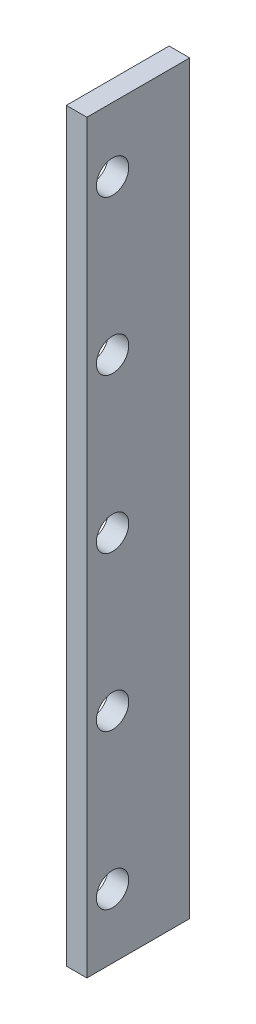
from build123d import *

# Parameters (mm, degrees)
SKETCH1_W           = 16
SKETCH1_H           = 80
BOSS_EXTRUDE1_DEPTH = 580
SKETCH2_R           = 12.6
CUT_EXTRUDE1_DEPTH  = 586.709825767


with BuildPart() as part:
    # Sketch1 → Boss-Extrude1 (new body)
    with BuildSketch(Plane(origin=(0, 0, 0), x_dir=(1, 0, 0), z_dir=(0, 1, 0))):
        with Locations((8, 40)):
            Rectangle(SKETCH1_W, SKETCH1_H)
    extrude(amount=BOSS_EXTRUDE1_DEPTH)

    # Sketch2 → Cut-Extrude1 (cut, through all)
    with BuildSketch(Plane.ZY):
        with Locations((-20, 50)):
            Circle(SKETCH2_R)
        with Locations((-20, 170)):
            Circle(SKETCH2_R)
        with Locations((-20, 290)):
            Circle(SKETCH2_R)
        with Locations((-20, 410)):
            Circle(SKETCH2_R)
        with Locations((-20, 530)):
            Circle(SKETCH2_R)
    extrude(amount=-CUT_EXTRUDE1_DEPTH, mode=Mode.SUBTRACT)


solid = part.part
